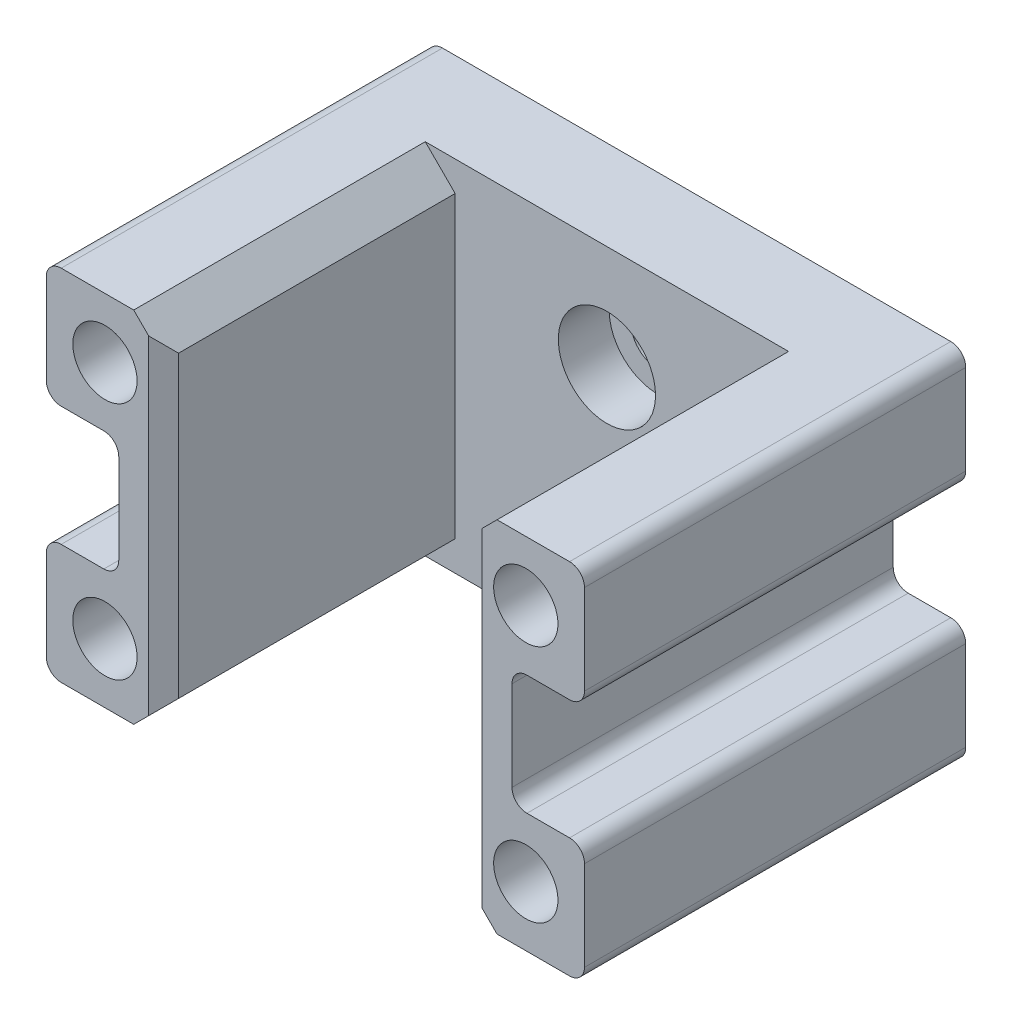
from build123d import *

# Parameters (mm, degrees)
SKETCH1_W                                           = 36
SKETCH1_H                                           = 24
BOSS_EXTRUDE1_DEPTH                                 = 6
CBORE_FOR_M3_HEX_SOCKET_HEAD_CAP_SCREW1_D           = 3.6
CBORE_FOR_M3_HEX_SOCKET_HEAD_CAP_SCREW1_DEPTH       = 12
CBORE_FOR_M3_HEX_SOCKET_HEAD_CAP_SCREW1_CBORE_D     = 6.5
CBORE_FOR_M3_HEX_SOCKET_HEAD_CAP_SCREW1_CBORE_DEPTH = 3.4
CBORE_FOR_M3_HEX_SOCKET_HEAD_CAP_SCREW1_TIP         = 1.081549114
BOSS_EXTRUDE2_DEPTH                                 = 19.5
SKETCH5_W                                           = 4.85
SKETCH5_H                                           = 8
CUT_EXTRUDE1_DEPTH                                  = 48.457876059
F_4_3_4_3_DIAMETER_HOLE1_D                          = 4.3
F_4_3_4_3_DIAMETER_HOLE1_DEPTH                      = 16
F_4_3_4_3_DIAMETER_HOLE1_TIP                        = 1.291850331
FILLET1_R                                           = 1
CHAMFER1_SIZE                                       = 2
CHAMFER2_SIZE                                       = 1


with BuildPart() as part:
    # Sketch1 → Boss-Extrude1 (new body)
    with BuildSketch(Plane.XY):
        with Locations((18, 12)):
            Rectangle(SKETCH1_W, SKETCH1_H)
    extrude(amount=BOSS_EXTRUDE1_DEPTH)

    # CBORE for M3 Hex Socket Head Cap Screw1
    with Locations(Plane.XY.offset(6)):
        with Locations((18, 17), (18, 7)):
            CounterBoreHole(CBORE_FOR_M3_HEX_SOCKET_HEAD_CAP_SCREW1_D / 2, CBORE_FOR_M3_HEX_SOCKET_HEAD_CAP_SCREW1_CBORE_D / 2, CBORE_FOR_M3_HEX_SOCKET_HEAD_CAP_SCREW1_CBORE_DEPTH, depth=CBORE_FOR_M3_HEX_SOCKET_HEAD_CAP_SCREW1_DEPTH)
            with Locations((0, 0, -(CBORE_FOR_M3_HEX_SOCKET_HEAD_CAP_SCREW1_DEPTH + CBORE_FOR_M3_HEX_SOCKET_HEAD_CAP_SCREW1_TIP / 2))):  # 118° drill point
                Cone(0, CBORE_FOR_M3_HEX_SOCKET_HEAD_CAP_SCREW1_D / 2, CBORE_FOR_M3_HEX_SOCKET_HEAD_CAP_SCREW1_TIP, mode=Mode.SUBTRACT)

    # Sketch4 → Boss-Extrude2 (add)
    with BuildSketch(Plane.XY.offset(6)):
        Polygon((7.85, 24), (0, 24), (0, 16), (4.85, 16), (4.85, 8), (0, 8), (0, 0), (7.85, 0), align=None)
        Polygon((36, 24), (28.15, 24), (28.15, 0), (36, 0), (36, 8), (31.15, 8), (31.15, 16), (36, 16), align=None)
    extrude(amount=BOSS_EXTRUDE2_DEPTH)

    # Sketch5 → Cut-Extrude1 (cut, through all)
    with BuildSketch(Plane.XY.offset(6)):
        with Locations((33.575, 12)):
            Rectangle(SKETCH5_W, SKETCH5_H)
        with Locations((2.425, 12)):
            Rectangle(SKETCH5_W, SKETCH5_H)
    extrude(amount=-CUT_EXTRUDE1_DEPTH, mode=Mode.SUBTRACT)

    # Ø4.3 (4.3) Diameter Hole1
    with Locations(Plane.XY.offset(25.5)):
        with Locations((3.925, 20), (3.925, 4), (32.075, 4), (32.075, 20)):
            Hole(F_4_3_4_3_DIAMETER_HOLE1_D / 2, depth=F_4_3_4_3_DIAMETER_HOLE1_DEPTH)
            with Locations((0, 0, -(F_4_3_4_3_DIAMETER_HOLE1_DEPTH + F_4_3_4_3_DIAMETER_HOLE1_TIP / 2))):  # 118° drill point
                Cone(0, F_4_3_4_3_DIAMETER_HOLE1_D / 2, F_4_3_4_3_DIAMETER_HOLE1_TIP, mode=Mode.SUBTRACT)

    # Fillet1
    fillet1_edges = [part.edges().sort_by_distance(p)[0] for p in [
        (0, 16, 12.75),
        (4.85, 16, 12.75),
        (4.85, 8, 12.75),
        (0, 8, 12.75),
        (36, 8, 12.75),
        (31.15, 8, 12.75),
        (31.15, 16, 12.75),
        (36, 16, 12.75),
        (0, 24, 12.75),
        (36, 24, 12.75),
        (36, 0, 12.75),
        (0, 0, 12.75),
    ]]
    fillet(fillet1_edges, radius=FILLET1_R)

    # Chamfer1
    chamfer1_edges = [part.edges().sort_by_distance(p)[0] for p in [
        (7.85, 0, 15.75),
        (7.85, 24, 15.75),
        (28.15, 24, 15.75),
        (28.15, 0, 15.75),
    ]]
    chamfer(chamfer1_edges, length=CHAMFER1_SIZE)

    # Chamfer2
    chamfer2_edges = [part.edges().sort_by_distance(p)[0] for p in [
        (28.15, 12, 25.5),
        (7.85, 12, 25.5),
    ]]
    chamfer(chamfer2_edges, length=CHAMFER2_SIZE)


solid = part.part
